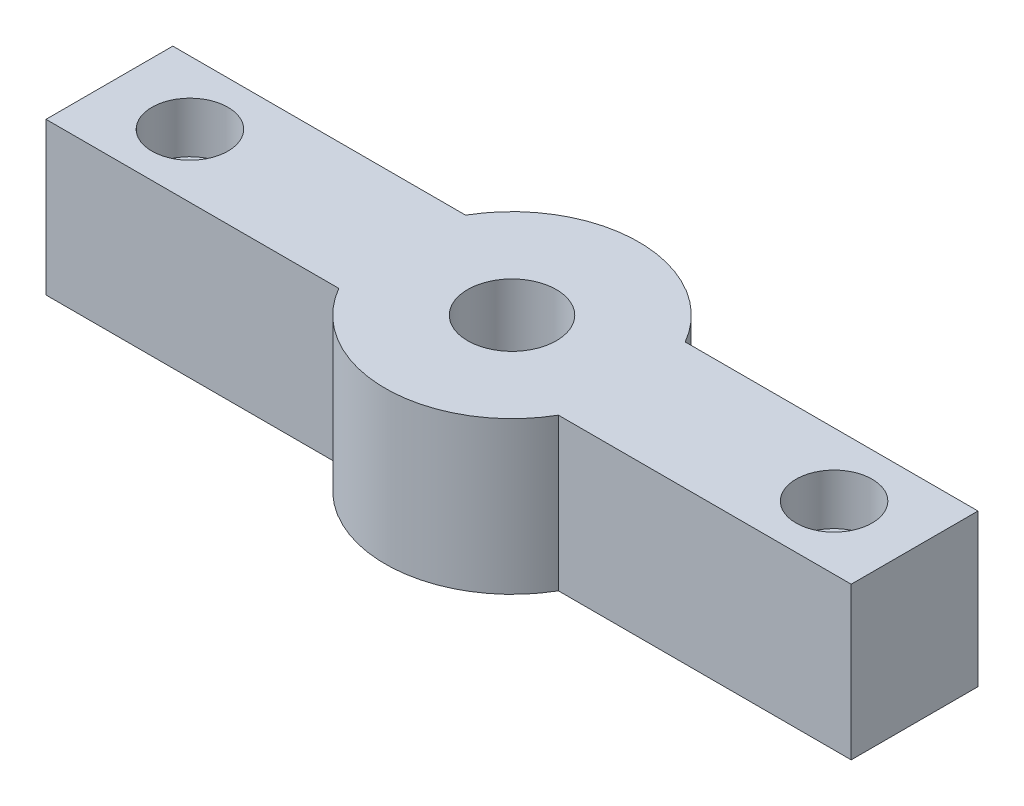
from build123d import *

# Parameters (mm, degrees)
SKETCH1_R           = 0.889
SKETCH1_R_2         = 1.75
BOSS_EXTRUDE1_DEPTH = 6
SKETCH2_R           = 1.5
CUT_EXTRUDE1_DEPTH  = 2


with BuildPart() as part:
    # Sketch1 → Boss-Extrude1 (new body)
    with BuildSketch(Plane(origin=(0, 0, 0), x_dir=(1, 0, 0), z_dir=(0, 1, 0))):
        with BuildLine():
            Line((-15.875, 2.5), (-15.875, -2.5))
            Line((-15.875, -2.5), (-4.330127019, -2.5))
            ThreePointArc((-4.330127019, -2.5), (0, -5), (4.330127019, -2.5))
            Line((4.330127019, -2.5), (15.875, -2.5))
            Line((15.875, -2.5), (15.875, 2.5))
            Line((15.875, 2.5), (4.330127019, 2.5))
            ThreePointArc((4.330127019, 2.5), (0, 5), (-4.330127019, 2.5))
            Line((-4.330127019, 2.5), (-15.875, 2.5))
        make_face()
        with Locations(Location((-12.7, 0, 0), (0, 0, 270))):
            Circle(SKETCH1_R, mode=Mode.SUBTRACT)
        with Locations(Location((0, 0, 0), (0, 0, 270))):
            Circle(SKETCH1_R_2, mode=Mode.SUBTRACT)
        with Locations(Location((12.7, 0, 0), (0, 0, 90))):
            Circle(SKETCH1_R, mode=Mode.SUBTRACT)
    extrude(amount=BOSS_EXTRUDE1_DEPTH)

    # Sketch2 → Cut-Extrude1 (cut)
    with BuildSketch(Plane(origin=(0, 6, 0), x_dir=(1, 0, 0), z_dir=(0, 1, 0))):
        with Locations(Location((-12.7, 0, 0), (0, 0, 270))):
            Circle(SKETCH2_R)
        with Locations(Location((12.7, 0, 0), (0, 0, 270))):
            Circle(SKETCH2_R)
    extrude(amount=-CUT_EXTRUDE1_DEPTH, mode=Mode.SUBTRACT)


solid = part.part
